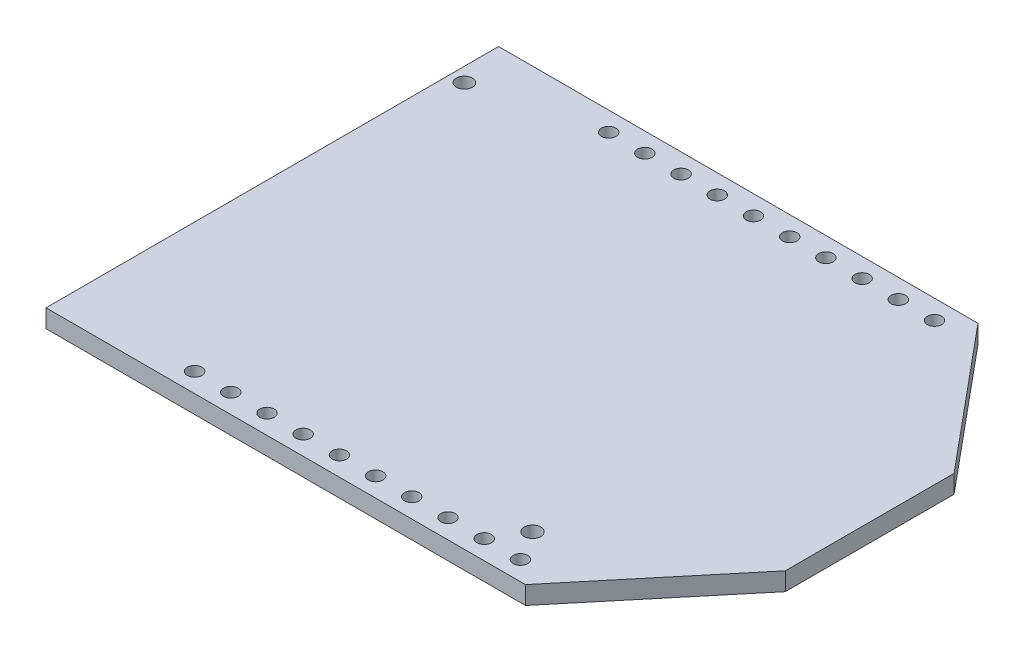
from build123d import *

# Parameters (mm, degrees)
SKETCH1_W           = 33
SKETCH1_H           = 25
BOSS_EXTRUDE1_DEPTH = 1
CUT_EXTRUDE1_DEPTH  = 42.412558482
SKETCH3_R           = 0.4
SKETCH3_R_2         = 0.442084783
SKETCH3_R_3         = 0.458227678
CUT_EXTRUDE2_DEPTH  = 42.412558482
BOSS_EXTRUDE3_DEPTH = 2


with BuildPart() as part:
    # Sketch1 → Boss-Extrude1 (new body)
    with BuildSketch(Plane(origin=(0, 0, 0), x_dir=(1, 0, 0), z_dir=(0, 1, 0))):
        with Locations((16.5, 12.5)):
            Rectangle(SKETCH1_W, SKETCH1_H)
    extrude(amount=BOSS_EXTRUDE1_DEPTH)

    # Sketch2 → Cut-Extrude1 (cut, through all)
    with BuildSketch(Plane.XZ):
        Polygon((33, 0), (26.482981269, 0), (33, -7.837809095), align=None)
        Polygon((33, -17.162190905), (33, -25), (26.482981269, -25), align=None)
    extrude(amount=-CUT_EXTRUDE1_DEPTH, mode=Mode.SUBTRACT)

    # Sketch3 → Cut-Extrude2 (cut, through all)
    with BuildSketch(Plane(origin=(0, 1, 0), x_dir=(1, 0, 0), z_dir=(0, 1, 0))):
        with Locations(Location((7.143852183, 23.936106005, 0), (0, 0, 270))):
            Circle(SKETCH3_R)
        with Locations(Location((9.143852183, 23.936106005, 0), (0, 0, 270))):
            Circle(SKETCH3_R)
        with Locations(Location((11.143852183, 23.936106005, 0), (0, 0, 270))):
            Circle(SKETCH3_R)
        with Locations(Location((13.143852183, 23.936106005, 0), (0, 0, 270))):
            Circle(SKETCH3_R)
        with Locations(Location((15.143852183, 23.936106005, 0), (0, 0, 270))):
            Circle(SKETCH3_R)
        with Locations(Location((17.143852183, 23.936106005, 0), (0, 0, 270))):
            Circle(SKETCH3_R)
        with Locations(Location((19.143852183, 23.936106005, 0), (0, 0, 270))):
            Circle(SKETCH3_R)
        with Locations(Location((21.143852183, 23.936106005, 0), (0, 0, 270))):
            Circle(SKETCH3_R)
        with Locations(Location((23.143852183, 23.936106005, 0), (0, 0, 270))):
            Circle(SKETCH3_R)
        with Locations(Location((25.143852183, 23.936106005, 0), (0, 0, 270))):
            Circle(SKETCH3_R)
        with Locations(Location((25.143852183, 1.063893995, 0), (0, 0, 90))):
            Circle(SKETCH3_R)
        with Locations(Location((23.143852183, 1.063893995, 0), (0, 0, 90))):
            Circle(SKETCH3_R)
        with Locations(Location((21.143852183, 1.063893995, 0), (0, 0, 90))):
            Circle(SKETCH3_R)
        with Locations(Location((19.143852183, 1.063893995, 0), (0, 0, 90))):
            Circle(SKETCH3_R)
        with Locations(Location((17.143852183, 1.063893995, 0), (0, 0, 90))):
            Circle(SKETCH3_R)
        with Locations(Location((15.143852183, 1.063893995, 0), (0, 0, 90))):
            Circle(SKETCH3_R)
        with Locations(Location((13.143852183, 1.063893995, 0), (0, 0, 90))):
            Circle(SKETCH3_R)
        with Locations(Location((11.143852183, 1.063893995, 0), (0, 0, 90))):
            Circle(SKETCH3_R)
        with Locations(Location((9.143852183, 1.063893995, 0), (0, 0, 90))):
            Circle(SKETCH3_R)
        with Locations(Location((7.143852183, 1.063893995, 0), (0, 0, 90))):
            Circle(SKETCH3_R)
        with Locations(Location((0.784299075, 22.325061426, 0), (0, 0, 270))):
            Circle(SKETCH3_R_2)
        with Locations(Location((24.152709784, 2.722277331, 0), (0, 0, 270))):
            Circle(SKETCH3_R_3)
    extrude(amount=-CUT_EXTRUDE2_DEPTH, mode=Mode.SUBTRACT)

    # Sketch6 → Boss-Extrude3 (add)
    with BuildSketch(Plane.XZ):
        with BuildLine():
            Line((24.507853381, -22.428957603), (0.778175079, -22.428957603))
            ThreePointArc((0.778175079, -22.428957603), (0.424621688, -22.282510994), (0.278175079, -21.928957603))
            Line((0.278175079, -21.928957603), (0.278175079, -2.903294195))
            ThreePointArc((0.278175079, -2.903294195), (0.424621688, -2.549740805), (0.778175079, -2.403294195))
            Line((0.778175079, -2.403294195), (24.507853381, -2.403294195))
            ThreePointArc((24.507853381, -2.403294195), (24.861406772, -2.549740805), (25.007853381, -2.903294195))
            Line((25.007853381, -2.903294195), (25.007853381, -21.928957603))
            ThreePointArc((25.007853381, -21.928957603), (24.861406772, -22.282510994), (24.507853381, -22.428957603))
        make_face()
    extrude(amount=BOSS_EXTRUDE3_DEPTH)


solid = part.part
